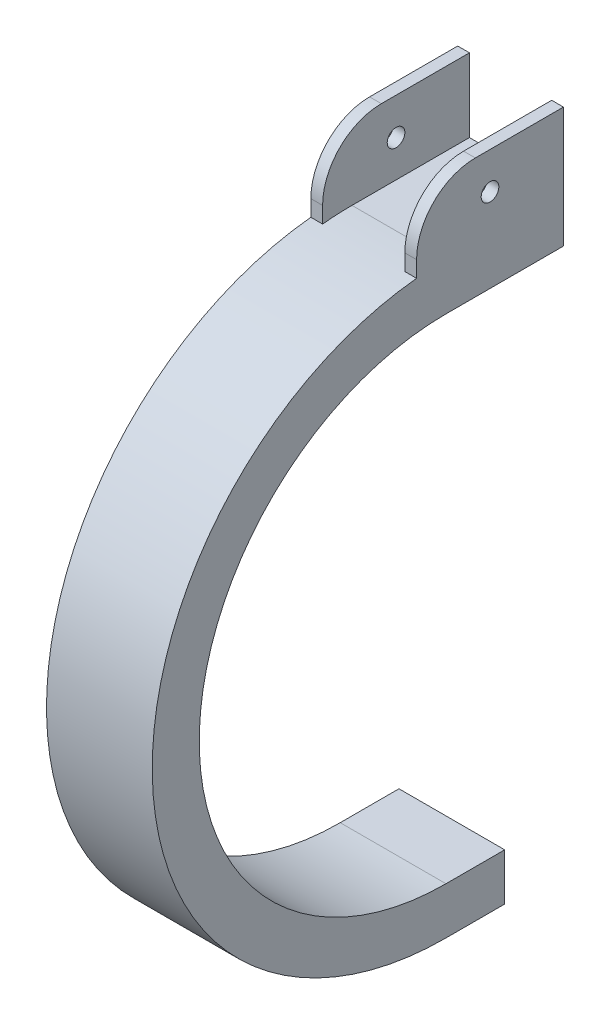
from build123d import *

# Parameters (mm, degrees)
BOSS_EXTRUDE1_DEPTH = 18
SKETCH2_W           = 25
SKETCH2_H           = 16.5
BOSS_EXTRUDE2_DEPTH = 2
SKETCH3_W           = 25
SKETCH3_H           = 16.5
BOSS_EXTRUDE3_DEPTH = 2
SKETCH4_R           = 1.5
CUT_EXTRUDE1_DEPTH  = 32
FILLET1_R           = 10


with BuildPart() as part:
    # Sketch1 → Boss-Extrude1 (new body)
    with BuildSketch(Plane(origin=(0, 0, 0), x_dir=(0, 0, -1), z_dir=(1, 0, 0))):
        with BuildLine():
            Line((0, -42), (10, -42))
            Line((10, -42), (10, -50))
            Line((10, -50), (0, -50))
            ThreePointArc((0, -50), (-50, 0), (0, 50))
            Line((0, 50), (20, 50))
            Line((20, 50), (20, 42))
            Line((20, 42), (0, 42))
            ThreePointArc((0, 42), (-42, 0), (0, -42))
        make_face()
    extrude(amount=BOSS_EXTRUDE1_DEPTH)

    # Sketch2 → Boss-Extrude2 (add)
    with BuildSketch(Plane(origin=(18, 0, 0), x_dir=(0, 0, -1), z_dir=(1, 0, 0))):
        with Locations((7.5, 54.25)):
            Rectangle(SKETCH2_W, SKETCH2_H)
    extrude(amount=-BOSS_EXTRUDE2_DEPTH)

    # Sketch3 → Boss-Extrude3 (add)
    with BuildSketch(Plane.ZY):
        with Locations((-7.5, 54.25)):
            Rectangle(SKETCH3_W, SKETCH3_H)
    extrude(amount=-BOSS_EXTRUDE3_DEPTH)

    # Sketch4 → Cut-Extrude1 (cut)
    with BuildSketch(Plane.ZY):
        with Locations((-7.5, 56.25)):
            Circle(SKETCH4_R)
    extrude(amount=-CUT_EXTRUDE1_DEPTH, mode=Mode.SUBTRACT)

    # Fillet1
    fillet1_edges = [part.edges().sort_by_distance(p)[0] for p in [
        (17, 62.5, 5),
        (1, 62.5, 5),
    ]]
    fillet(fillet1_edges, radius=FILLET1_R)


solid = part.part
